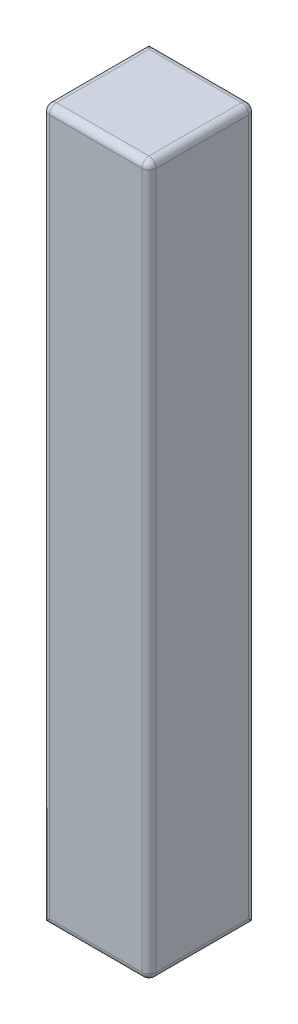
from build123d import *

# Parameters (mm, degrees)
SKETCH1_W           = 3
SKETCH1_H           = 3
BOSS_EXTRUDE1_DEPTH = 20
FILLET1_R           = 0.2


with BuildPart() as part:
    # Sketch1 → Boss-Extrude1 (new body)
    with BuildSketch(Plane(origin=(0, 0, 0), x_dir=(1, 0, 0), z_dir=(0, 1, 0))):
        with Locations((1.5, 1.5)):
            Rectangle(SKETCH1_W, SKETCH1_H)
    extrude(amount=BOSS_EXTRUDE1_DEPTH)

    # Fillet1
    fillet1_edges = [part.edges().sort_by_distance(p)[0] for p in [
        (3, 20, -1.5),
        (1.5, 20, -3),
        (0, 20, -1.5),
        (3, 0, -1.5),
        (1.5, 0, 0),
        (1.5, 20, 0),
        (3, 10, -3),
        (3, 10, 0),
        (0, 10, 0),
    ]]
    fillet(fillet1_edges, radius=FILLET1_R)


solid = part.part
